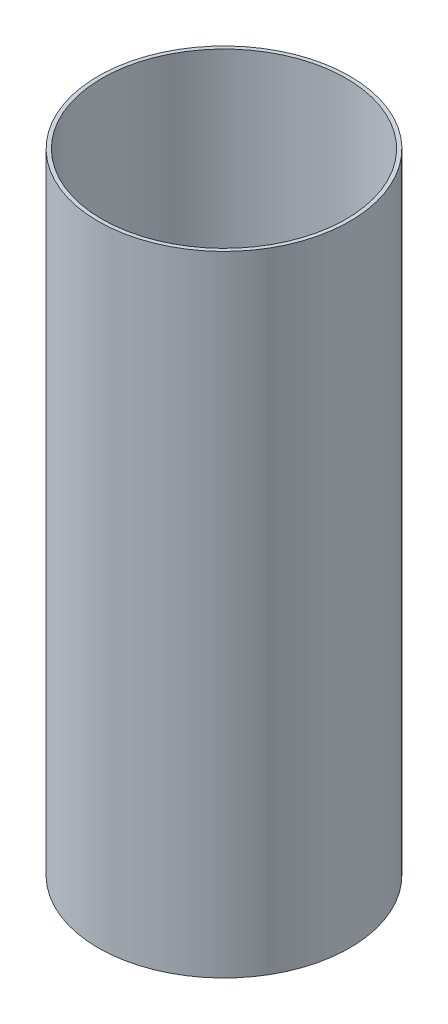
from build123d import *

# Parameters (mm, degrees)
SKETCH1_R           = 76.1746
SKETCH1_R_2         = 73.914
BOSS_EXTRUDE1_DEPTH = 381


with BuildPart() as part:
    # Sketch1 → Boss-Extrude1 (new body)
    with BuildSketch(Plane(origin=(0, 0, 0), x_dir=(1, 0, 0), z_dir=(0, 1, 0))):
        with Locations(Location((0, 0, 0), (0, 0, 270))):
            Circle(SKETCH1_R)
        with Locations(Location((0, 0, 0), (0, 0, 270))):
            Circle(SKETCH1_R_2, mode=Mode.SUBTRACT)
    extrude(amount=BOSS_EXTRUDE1_DEPTH)


solid = part.part
